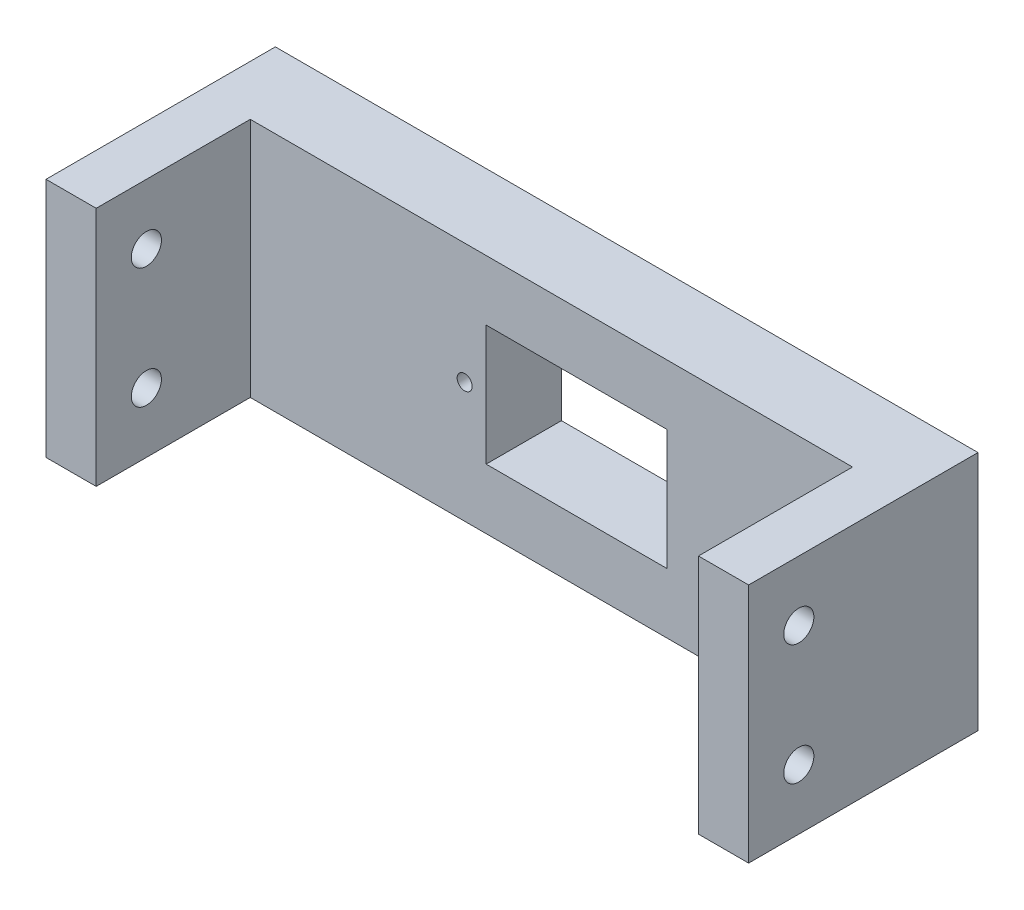
from build123d import *

# Parameters (mm, degrees)
SKETCH1_W           = 5
SKETCH1_H           = 15.35
BOSS_EXTRUDE1_DEPTH = 24
SKETCH2_R           = 1.5
CUT_EXTRUDE1_DEPTH  = 77.425192182
CUT_EXTRUDE4_REACH  = 50.199
SKETCH8_W           = 18
SKETCH8_H           = 12
SKETCH9_R           = 0.75
CUT_EXTRUDE5_DEPTH  = 49.198781105


with BuildPart() as part:
    # Sketch1 → Boss-Extrude1 (new body)
    with BuildSketch(Plane(origin=(0, 0, 0), x_dir=(1, 0, 0), z_dir=(0, 1, 0))):
        with Locations((-32.5, -11.425)):
            Rectangle(SKETCH1_W, SKETCH1_H)
        Polygon((-35, -3.75), (-30, -3.75), (0, -3.75), (0, 3.75), (-35, 3.75), align=None)
        Polygon((0, 3.75), (0, -3.75), (30, -3.75), (35, -3.75), (35, 3.75), align=None)
        with Locations((32.5, -11.425)):
            Rectangle(SKETCH1_W, SKETCH1_H)
    extrude(amount=BOSS_EXTRUDE1_DEPTH)

    # Sketch2 → Cut-Extrude1 (cut, through all)
    with BuildSketch(Plane.ZY.offset(35)):
        with Locations((14.1, 18)):
            Circle(SKETCH2_R)
        with Locations((14.1, 6)):
            Circle(SKETCH2_R)
    extrude(amount=-CUT_EXTRUDE1_DEPTH, mode=Mode.SUBTRACT)

    # Sketch8 → Cut-Extrude4 (cut, up to next)
    with BuildSketch(Plane(origin=(0, 0, -3.75), x_dir=(-1, 0, 0), z_dir=(0, 0, -1)), mode=Mode.PRIVATE) as cut_extrude4_sk1:
        with Locations((-2.5, 12)):
            Rectangle(SKETCH8_W, SKETCH8_H)
    cut_extrude4_tool1 = extrude(cut_extrude4_sk1.sketch, amount=-CUT_EXTRUDE4_REACH, mode=Mode.PRIVATE) & part.part
    add(cut_extrude4_tool1.solids().sort_by_distance((2.5, 12, -3.75))[0], mode=Mode.SUBTRACT)

    # Sketch9 → Cut-Extrude5 (cut, through all)
    with BuildSketch(Plane(origin=(0, 0, -3.75), x_dir=(-1, 0, 0), z_dir=(0, 0, -1))):
        with Locations((-19.16, 12)):
            Circle(SKETCH9_R)
        with Locations((8.64, 12)):
            Circle(SKETCH9_R)
    extrude(amount=-CUT_EXTRUDE5_DEPTH, mode=Mode.SUBTRACT)


solid = part.part
